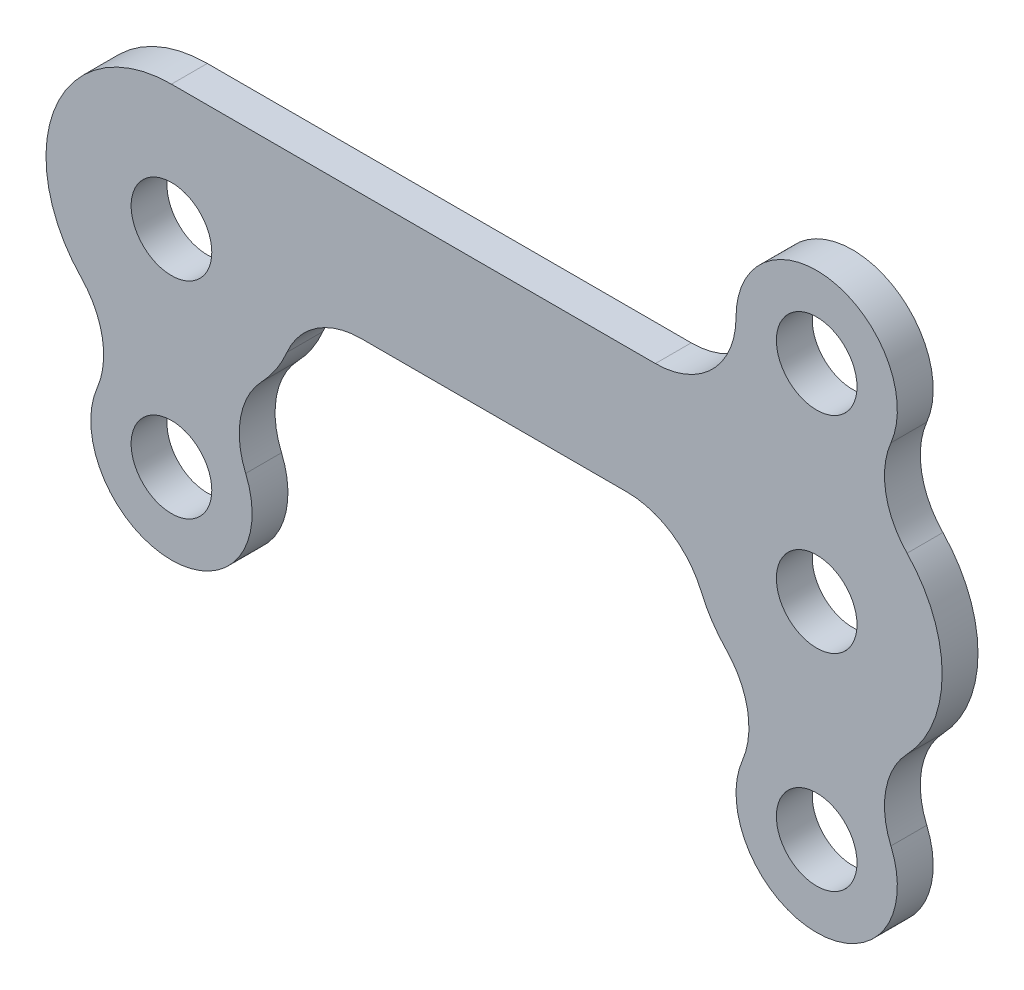
from build123d import *

# Parameters (mm, degrees)
SKETCH1_R           = 1.7859375
BOSS_EXTRUDE1_DEPTH = 1.5875
FILLET1_R           = 3.571875


with BuildPart() as part:
    # Sketch1 → Boss-Extrude1 (new body)
    with BuildSketch(Plane.XY):
        with BuildLine():
            ThreePointArc((4.001636181, -3.854714248), (5.152960561, -2.078199104), (5.55625, 0))
            Line((5.55625, 0), (23.01875, 0))
            ThreePointArc((23.01875, 0), (23.422039397, -2.078199001), (24.573363664, -3.854714088))
            ThreePointArc((24.573363664, -3.854714088), (25.513553345, -5.68510334), (25.287941571, -7.730434799))
            ThreePointArc((25.287941571, -7.730434799), (28.575000018, -12.7), (31.862058415, -7.730434766))
            ThreePointArc((31.862058415, -7.730434766), (31.636446643, -5.685103406), (32.576636217, -3.854714211))
            ThreePointArc((32.576636217, -3.854714211), (34.13125, -2e-08), (32.576636245, 3.854714182))
            ThreePointArc((32.576636245, 3.854714182), (31.636446652, 5.685103357), (31.862058392, 7.730434711))
            ThreePointArc((31.862058392, 7.730434711), (29.288207306, 12.628071622), (25.003125, 9.128125))
            ThreePointArc((25.003125, 9.128125), (23.956947034, 6.602427966), (21.43125, 5.55625))
            Line((21.43125, 5.55625), (0, 5.55625))
            ThreePointArc((0, 5.55625), (-5.113202033, 2.174184683), (-4.00163619, -3.85471424))
            ThreePointArc((-4.00163619, -3.85471424), (-3.061446646, -5.685103393), (-3.287058389, -7.730434703))
            ThreePointArc((-3.287058389, -7.730434703), (1.4e-08, -12.7), (3.287058378, -7.730434678))
            ThreePointArc((3.287058378, -7.730434678), (3.061446647, -5.685103385), (4.001636181, -3.854714248))
        make_face()
        Circle(SKETCH1_R, mode=Mode.SUBTRACT)
        with Locations((28.575, 0)):
            Circle(SKETCH1_R, mode=Mode.SUBTRACT)
        with Locations((0, -9.128125)):
            Circle(SKETCH1_R, mode=Mode.SUBTRACT)
        with Locations((28.575, -9.128125)):
            Circle(SKETCH1_R, mode=Mode.SUBTRACT)
        with Locations((28.575, 9.128125)):
            Circle(SKETCH1_R, mode=Mode.SUBTRACT)
    extrude(amount=BOSS_EXTRUDE1_DEPTH)

    # Fillet1
    fillet1_edges = [part.edges().sort_by_distance(p)[0] for p in [
        (23.01875, 0, 0.79375),
        (5.55625, 0, 0.79375),
    ]]
    fillet(fillet1_edges, radius=FILLET1_R)


solid = part.part
